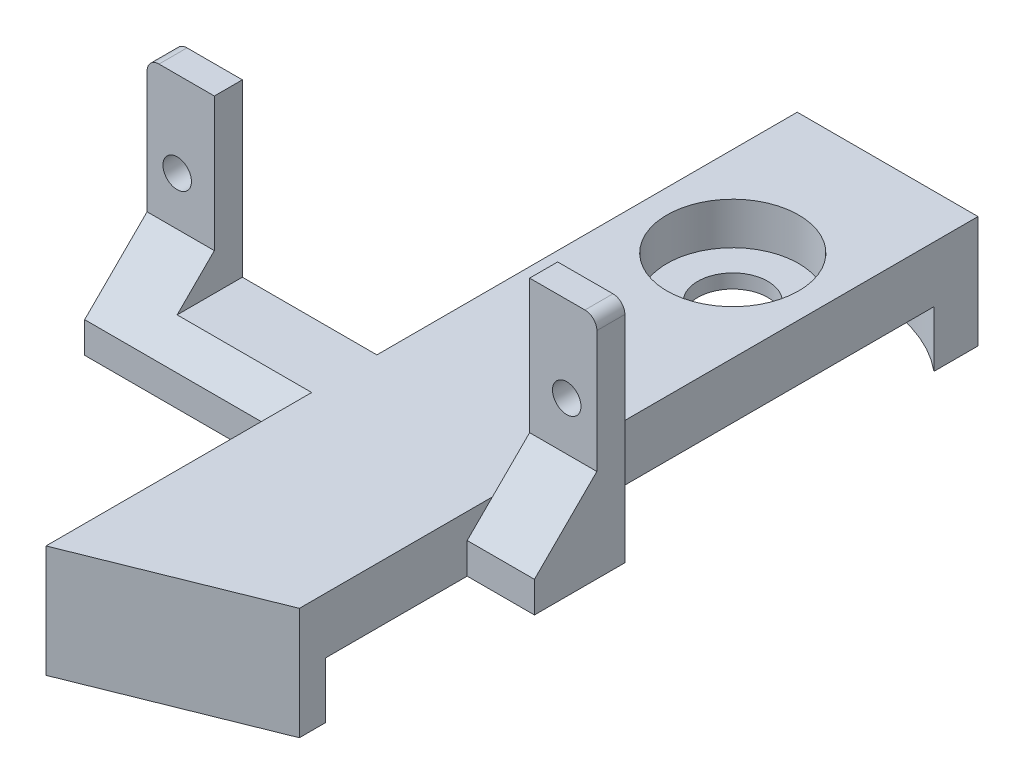
from build123d import *

# Parameters (mm, degrees)
SKETCH1_R           = 1.016
BOSS_EXTRUDE1_DEPTH = 2
SKETCH2_R           = 4.7
BOSS_EXTRUDE2_DEPTH = 3
BOSS_EXTRUDE5_DEPTH = 8
BOSS_EXTRUDE6_START = -27.3
BOSS_EXTRUDE6_DEPTH = 32.1
SKETCH4_W           = 22.5
SKETCH4_H           = 14.127681706
CUT_EXTRUDE1_DEPTH  = 7
FILLET1_R           = 0.5
SKETCH5_R           = 2.5
BOSS_EXTRUDE7_DEPTH = 1
SKETCH6_W           = 5.313656685
SKETCH6_H           = 4.599259183
SKETCH6_W_2         = 16.163165117
SKETCH6_H_2         = 5.344557169
CUT_EXTRUDE2_DEPTH  = 5


with BuildPart() as part:
    # Sketch1 → Boss-Extrude1 (new body)
    # profile 1 of 4: a face of its own
    with BuildSketch(Plane.XY):
        with BuildLine():
            Line((-16.05, 5.25), (-16.05, -5.25))
            ThreePointArc((-16.05, -5.25), (-15.801040764, -5.851040764), (-15.2, -6.1))
            Line((-15.2, -6.1), (-11.25, -6.1))
            Line((-11.25, -6.1), (-11.25, 6.1))
            Line((-11.25, 6.1), (-15.2, 6.1))
            ThreePointArc((-15.2, 6.1), (-15.801040764, 5.851040764), (-16.05, 5.25))
        make_face()
        with Locations((-13.9, 0)):
            Circle(SKETCH1_R, mode=Mode.SUBTRACT)
    # profile 2 of 4: a face of its own
    with BuildSketch(Plane.XY):
        with BuildLine():
            Line((16.05, 5.25), (16.05, -5.25))
            ThreePointArc((16.05, -5.25), (15.801040764, -5.851040764), (15.2, -6.1))
            Line((15.2, -6.1), (11.25, -6.1))
            Line((11.25, -6.1), (11.25, 6.094097151))
            Line((11.25, 6.094097151), (15.2, 6.1))
            ThreePointArc((15.2, 6.1), (15.801040764, 5.851040764), (16.05, 5.25))
        make_face()
        with Locations((13.9, 0)):
            Circle(SKETCH1_R, mode=Mode.SUBTRACT)
    # profile 3 of 4: a face of its own
    with BuildSketch(Plane.XY):
        with BuildLine():
            ThreePointArc((15.2, -6.1), (15.801040764, -5.851040764), (16.05, -5.25))
            Line((16.05, -5.25), (16.05, -6.1))
            Line((16.05, -6.1), (15.2, -6.1))
        make_face()
    # profile 4 of 4: a face of its own
    with BuildSketch(Plane.XY):
        with BuildLine():
            ThreePointArc((-16.05, -5.25), (-15.801040764, -5.851040764), (-15.2, -6.1))
            Line((-15.2, -6.1), (-16.05, -6.1))
            Line((-16.05, -6.1), (-16.05, -5.25))
        make_face()
    extrude(amount=BOSS_EXTRUDE1_DEPTH)

    # Sketch2 → Boss-Extrude2 (add)
    with BuildSketch(Plane.XZ.offset(6.1)):
        Polygon((16.05, 2), (11.25, 2), (11.25, 18.429366849), (-1.65, 23.613902023), (-1.65, 2), (-16.05, 2), (-16.05, 0), (-1.65, 0), (-1.65, -29.999830432), (11.25, -29.999830432), (11.25, 0), (16.05, 0), align=None)
        with Locations((4.75, -19)):
            Circle(SKETCH2_R, mode=Mode.SUBTRACT)
    extrude(amount=BOSS_EXTRUDE2_DEPTH)

    # Sketch2<3> → Boss-Extrude5 (add)
    with BuildSketch(Plane.XZ.offset(6.1)):
        with BuildLine():
            ThreePointArc((8.578413339, 18.144332102), (9.979514579, 17.458386729), (11.25, 16.553139508))
            Line((11.25, 16.553139508), (11.25, 18.429366849))
            Line((11.25, 18.429366849), (-1.65, 23.613902023))
            Line((-1.65, 23.613902023), (-1.65, 22.612965014))
            Line((-1.65, 22.612965014), (-1.57491206, 22.257159966))
            Line((-1.57491206, 22.257159966), (8.578413339, 18.144332102))
        make_face()
        with BuildLine():
            ThreePointArc((0.350023778, -29.2), (-0.651218811, -29.175170712), (-1.65, -29.100743889))
            Line((-1.65, -29.100743889), (-1.65, -29.999830432))
            Line((-1.65, -29.999830432), (11.25, -29.999830432))
            Line((11.25, -29.999830432), (11.25, -26.86066155))
            ThreePointArc((11.25, -26.86066155), (8.204073841, -28.597362862), (4.75, -29.2))
            Line((4.75, -29.2), (0.350023778, -29.2))
        make_face()
    extrude(amount=BOSS_EXTRUDE5_DEPTH)

    # Sketch3 → Boss-Extrude6 (add)
    with BuildSketch(Plane(origin=(11.25, 0, 0), x_dir=(0, 0, -1), z_dir=(1, 0, 0)).offset(BOSS_EXTRUDE6_START)):
        Polygon((-7.665828596, -9.1), (-2, -3.457464127), (-2, -9.1), align=None)
    extrude(amount=BOSS_EXTRUDE6_DEPTH)

    # Sketch4 → Cut-Extrude1 (cut)
    with BuildSketch(Plane(origin=(0, -6.1, 0), x_dir=(1, 0, 0), z_dir=(0, 1, 0))):
        with Locations((0, -7.063840853)):
            Rectangle(SKETCH4_W, SKETCH4_H)
    extrude(amount=CUT_EXTRUDE1_DEPTH, mode=Mode.SUBTRACT)

    # Fillet1
    fillet1_edges = [part.edges().sort_by_distance(p)[0] for p in [
        (13.65, -9.1, 7.665828596),
        (-8.85, -9.1, 7.665828596),
    ]]
    fillet(fillet1_edges, radius=FILLET1_R)

    # Sketch5 → Boss-Extrude7 (add)
    with BuildSketch(Plane.XZ.offset(9.1)):
        with BuildLine():
            Line((-1.65, 22.612965014), (-1.65, 6.455196792))
            Line((-1.65, 6.455196792), (-16.05, 6.455196792))
            Line((-16.05, 6.455196792), (-16.05, 0))
            Line((-16.05, 0), (-1.65, 0))
            Line((-1.65, 0), (-1.65, -29.100743889))
            ThreePointArc((-1.65, -29.100743889), (-0.651218811, -29.175170712), (0.350023778, -29.2))
            Line((0.350023778, -29.2), (4.75, -29.2))
            ThreePointArc((4.75, -29.2), (8.204073841, -28.597362862), (11.25, -26.86066155))
            Line((11.25, -26.86066155), (11.25, 0))
            Line((11.25, 0), (16.05, 0))
            Line((16.05, 0), (16.05, 6.455196792))
            Line((16.05, 6.455196792), (11.25, 6.455196792))
            Line((11.25, 6.455196792), (11.25, 16.553139508))
            ThreePointArc((11.25, 16.553139508), (9.979514579, 17.458386729), (8.578413339, 18.144332102))
            Line((8.578413339, 18.144332102), (-1.57491206, 22.257159966))
            Line((-1.57491206, 22.257159966), (-1.65, 22.612965014))
        make_face()
        with Locations((4.75, -19)):
            Circle(SKETCH5_R, mode=Mode.SUBTRACT)
    extrude(amount=BOSS_EXTRUDE7_DEPTH)

    # Sketch6 → Cut-Extrude2 (cut)
    with BuildSketch(Plane.XY.offset(6.455196792)):
        with Locations((13.906828343, -7.800370409)):
            Rectangle(SKETCH6_W, SKETCH6_H)
        with Locations((-9.731582558, -7.427721416)):
            Rectangle(SKETCH6_W_2, SKETCH6_H_2)
    extrude(amount=CUT_EXTRUDE2_DEPTH, mode=Mode.SUBTRACT)


solid = part.part
